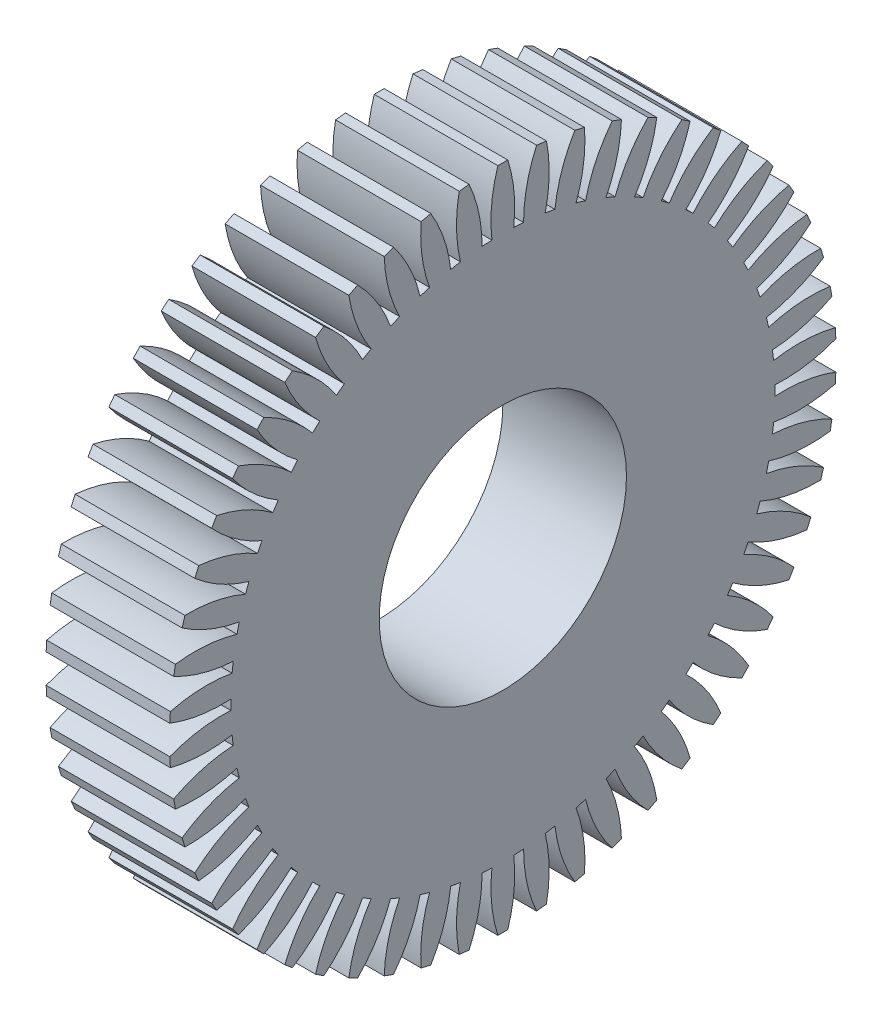
from build123d import *

# Parameters (mm, degrees)
SKETCH1_R               = 135
BOSS_EXTRUDE1_DEPTH     = 50
CUT_EXTRUDE1_DEPTH      = 198.35754356
CUT_EXTRUDE1_DEPTH_BACK = 198.35754356
SKETCH2_OUTSIDE_W       = 349.02
SKETCH2_OUTSIDE_H       = 349.02
CUT_EXTRUDE2_DEPTH      = 197.968696738
CUT_EXTRUDE2_DEPTH_BACK = 197.968696738
SKETCH3_R               = 50


with BuildPart() as part:
    # Sketch1 → Boss-Extrude1 (new body)
    with BuildSketch(Plane.YZ):
        with Locations(Location((0, 0, 0), (0, 0, 270))):
            Circle(SKETCH1_R)
    extrude(amount=BOSS_EXTRUDE1_DEPTH)

    # Sketch2 outside → Cut-Extrude1 (cut, two sides: drawn at the far end of the back side and taken through both)
    with BuildSketch(Plane.YZ.offset(50).offset(-CUT_EXTRUDE1_DEPTH_BACK)):
        Rectangle(SKETCH2_OUTSIDE_W, SKETCH2_OUTSIDE_H)
        with BuildLine():
            Line((5.839655387, 134.659878805), (9.83288802, 134.42729949))
            ThreePointArc((9.83288802, 134.42729949), (11.644041367, 121.999640209), (10.781632884, 109.470344808))
            ThreePointArc((10.781632884, 109.470344808), (12.770220554, 109.256219352), (14.754586315, 109.005973151))
            ThreePointArc((14.754586315, 109.005973151), (16.804878532, 121.396424857), (21.433227473, 133.071414267))
            Line((21.433227473, 133.071414267), (25.372458485, 132.376821556))
            ThreePointArc((25.372458485, 132.376821556), (25.728602279, 119.822931592), (23.417462678, 107.478474318))
            ThreePointArc((23.417462678, 107.478474318), (25.367745782, 107.034935764), (27.30964216, 106.556010835))
            ThreePointArc((27.30964216, 106.556010835), (30.784514681, 118.62465834), (36.736951925, 129.683387133))
            Line((36.736951925, 129.683387133), (40.568909974, 128.536174202))
            ThreePointArc((40.568909974, 128.536174202), (39.465227982, 116.025823379), (35.736611462, 104.03314184))
            ThreePointArc((35.736611462, 104.03314184), (37.622215766, 103.366188286), (39.495381945, 102.665061267))
            ThreePointArc((39.495381945, 102.665061267), (44.34784308, 114.248696818), (51.543872124, 124.541614657))
            Line((51.543872124, 124.541614657), (55.216736552, 122.957295593))
            ThreePointArc((55.216736552, 122.957295593), (52.668154179, 110.659664946), (47.572483882, 99.180939587))
            ThreePointArc((47.572483882, 99.180939587), (49.367909822, 98.299590436), (51.147014443, 97.385742866))
            ThreePointArc((51.147014443, 97.385742866), (57.311442979, 108.327717664), (65.653749876, 117.715630492))
            Line((65.653749876, 117.715630492), (69.117851491, 115.715630492))
            ThreePointArc((69.117851491, 115.715630492), (65.158833941, 103.797024379), (58.765020067, 92.987485268))
            ThreePointArc((58.765020067, 92.987485268), (60.445987588, 91.903659255), (62.106971312, 90.789449356))
            ThreePointArc((62.106971312, 90.789449356), (69.500003928, 100.941791962), (78.875773288, 109.297744364))
            Line((78.875773288, 109.297744364), (82.084266059, 106.909109997))
            ThreePointArc((82.084266059, 106.909109997), (76.768352254, 95.530707119), (69.162860166, 85.53653473))
            ThreePointArc((69.162860166, 85.53653473), (70.706637066, 84.264888743), (72.227037938, 82.965384292))
            ThreePointArc((72.227037938, 82.965384292), (80.74869655, 92.190801688), (91.031137177, 99.401793742))
            Line((91.031137177, 99.401793742), (93.940631743, 96.656827191))
            ThreePointArc((93.940631743, 96.656827191), (87.339710297, 85.972500927), (78.625391229, 76.928849297))
            ThreePointArc((78.625391229, 76.928849297), (80.011100573, 75.486580166), (81.37035778, 74.01935473))
            ThreePointArc((81.37035778, 74.01935473), (90.905401575, 82.193088973), (101.955461098, 88.161604382))
            Line((101.955461098, 88.161604382), (104.526611537, 85.09742661))
            ThreePointArc((104.526611537, 85.09742661), (96.729948589, 75.251664145), (87.024648756, 67.280833146))
            ThreePointArc((87.024648756, 67.280833146), (88.233551203, 65.687445087), (89.413283123, 64.072340375))
            ThreePointArc((89.413283123, 64.072340375), (99.83276699, 71.083855731), (111.50101231, 75.729180563))
            Line((111.50101231, 75.729180563), (113.699048223, 72.387229317))
            ThreePointArc((113.699048223, 72.387229317), (104.812080264, 63.513177698), (94.247047198, 56.722959147))
            ThreePointArc((94.247047198, 56.722959147), (95.262794416, 55), (96.247047198, 53.258857532))
            ThreePointArc((96.247047198, 53.258857532), (107.410065493, 59.013335283), (119.538703609, 62.272649488))
            Line((119.538703609, 62.272649488), (121.33390033, 58.698118927))
            ThreePointArc((121.33390033, 58.698118927), (111.476808357, 50.915784478), (100.194916006, 45.398004433))
            ThreePointArc((100.194916006, 45.398004433), (101.003771757, 43.568774264), (101.779235071, 41.725140005))
            ThreePointArc((101.779235071, 41.725140005), (113.534827121, 46.144760712), (125.959839009, 47.973987657))
            Line((125.959839009, 47.973987657), (127.327919582, 44.215217174))
            ThreePointArc((127.327919582, 44.215217174), (116.634003854, 37.629842619), (104.787820458, 33.459119588))
            ThreePointArc((104.787820458, 33.459119588), (105.378846355, 31.548355598), (105.935033389, 29.627161538))
            ThreePointArc((105.935033389, 29.627161538), (118.124224979, 32.652157413), (130.677583668, 33.026559942))
            Line((130.677583668, 33.026559942), (131.600047151, 29.134380459))
            ThreePointArc((131.600047151, 29.134380459), (120.213924532, 23.835021691), (107.9636494, 21.067757549))
            ThreePointArc((107.9636494, 21.067757549), (108.328852831, 19.101299543), (108.658242111, 17.128526537))
            ThreePointArc((108.658242111, 17.128526537), (121.116195334, 18.717989699), (133.628138183, 17.632504659))
            Line((133.628138183, 17.632504659), (134.09250984, 13.659551228))
            ThreePointArc((134.09250984, 13.659551228), (122.168158107, 9.717872984), (109.679455194, 8.391490231))
            ThreePointArc((109.679455194, 8.391490231), (109.81389741, 6.39593118), (109.91203451, 4.398257598))
            ThreePointArc((109.91203451, 4.398257598), (122.47027692, 4.530693285), (134.771601367, 2))
            Line((134.771601367, 2), (134.771601367, -2))
            ThreePointArc((134.771601367, -2), (122.47027692, -4.530693285), (109.91203451, -4.398257598))
            ThreePointArc((109.91203451, -4.398257598), (109.81389741, -6.39593118), (109.679455194, -8.391490231))
            ThreePointArc((109.679455194, -8.391490231), (122.168158107, -9.717872984), (134.09250984, -13.659551228))
            Line((134.09250984, -13.659551228), (133.628138183, -17.632504659))
            ThreePointArc((133.628138183, -17.632504659), (121.116195334, -18.717989699), (108.658242111, -17.128526537))
            ThreePointArc((108.658242111, -17.128526537), (108.328852831, -19.101299543), (107.9636494, -21.067757549))
            ThreePointArc((107.9636494, -21.067757549), (120.213924532, -23.835021691), (131.600047151, -29.134380459))
            Line((131.600047151, -29.134380459), (130.677583668, -33.026559942))
            ThreePointArc((130.677583668, -33.026559942), (118.124224979, -32.652157413), (105.935033389, -29.627161538))
            ThreePointArc((105.935033389, -29.627161538), (105.378846355, -31.548355598), (104.787820458, -33.459119588))
            ThreePointArc((104.787820458, -33.459119588), (116.634003854, -37.629842619), (127.327919582, -44.215217174))
            Line((127.327919582, -44.215217174), (125.959839009, -47.973987657))
            ThreePointArc((125.959839009, -47.973987657), (113.534827121, -46.144760712), (101.779235071, -41.725140005))
            ThreePointArc((101.779235071, -41.725140005), (101.003771757, -43.568774264), (100.194916006, -45.398004433))
            ThreePointArc((100.194916006, -45.398004433), (111.476808357, -50.915784478), (121.33390033, -58.698118927))
            Line((121.33390033, -58.698118927), (119.538703609, -62.272649488))
            ThreePointArc((119.538703609, -62.272649488), (107.410065493, -59.013335283), (96.247047198, -53.258857532))
            ThreePointArc((96.247047198, -53.258857532), (95.262794416, -55), (94.247047198, -56.722959147))
            ThreePointArc((94.247047198, -56.722959147), (104.812080264, -63.513177698), (113.699048223, -72.387229317))
            Line((113.699048223, -72.387229317), (111.50101231, -75.729180563))
            ThreePointArc((111.50101231, -75.729180563), (99.83276699, -71.083855731), (89.413283123, -64.072340375))
            ThreePointArc((89.413283123, -64.072340375), (88.233551203, -65.687445087), (87.024648756, -67.280833146))
            ThreePointArc((87.024648756, -67.280833146), (96.729948589, -75.251664145), (104.526611537, -85.09742661))
            Line((104.526611537, -85.09742661), (101.955461098, -88.161604382))
            ThreePointArc((101.955461098, -88.161604382), (90.905401575, -82.193088973), (81.37035778, -74.01935473))
            ThreePointArc((81.37035778, -74.01935473), (80.011100573, -75.486580166), (78.625391229, -76.928849297))
            ThreePointArc((78.625391229, -76.928849297), (87.339710297, -85.972500927), (93.940631743, -96.656827191))
            Line((93.940631743, -96.656827191), (91.031137177, -99.401793742))
            ThreePointArc((91.031137177, -99.401793742), (80.74869655, -92.190801688), (72.227037938, -82.965384292))
            ThreePointArc((72.227037938, -82.965384292), (70.706637066, -84.264888743), (69.162860166, -85.53653473))
            ThreePointArc((69.162860166, -85.53653473), (76.768352254, -95.530707119), (82.084266059, -106.909109997))
            Line((82.084266059, -106.909109997), (78.875773288, -109.297744364))
            ThreePointArc((78.875773288, -109.297744364), (69.500003928, -100.941791962), (62.106971312, -90.789449356))
            ThreePointArc((62.106971312, -90.789449356), (60.445987588, -91.903659255), (58.765020067, -92.987485268))
            ThreePointArc((58.765020067, -92.987485268), (65.158833941, -103.797024379), (69.117851491, -115.715630492))
            Line((69.117851491, -115.715630492), (65.653749876, -117.715630492))
            ThreePointArc((65.653749876, -117.715630492), (57.311442979, -108.327717664), (51.147014443, -97.385742866))
            ThreePointArc((51.147014443, -97.385742866), (49.367909822, -98.299590436), (47.572483882, -99.180939587))
            ThreePointArc((47.572483882, -99.180939587), (52.668154179, -110.659664946), (55.216736552, -122.957295593))
            Line((55.216736552, -122.957295593), (51.543872124, -124.541614657))
            ThreePointArc((51.543872124, -124.541614657), (44.34784308, -114.248696818), (39.495381945, -102.665061267))
            ThreePointArc((39.495381945, -102.665061267), (37.622215766, -103.366188286), (35.736611462, -104.03314184))
            ThreePointArc((35.736611462, -104.03314184), (39.465227982, -116.025823379), (40.568909974, -128.536174202))
            Line((40.568909974, -128.536174202), (36.736951925, -129.683387133))
            ThreePointArc((36.736951925, -129.683387133), (30.784514681, -118.62465834), (27.30964216, -106.556010835))
            ThreePointArc((27.30964216, -106.556010835), (25.367745782, -107.034935764), (23.417462678, -107.478474318))
            ThreePointArc((23.417462678, -107.478474318), (25.728602279, -119.822931592), (25.372458485, -132.376821556))
            Line((25.372458485, -132.376821556), (21.433227473, -133.071414267))
            ThreePointArc((21.433227473, -133.071414267), (16.804878532, -121.396424857), (14.754586315, -109.005973151))
            ThreePointArc((14.754586315, -109.005973151), (12.770220554, -109.256219352), (10.781632884, -109.470344808))
            ThreePointArc((10.781632884, -109.470344808), (11.644041367, -121.999640209), (9.83288802, -134.42729949))
            Line((9.83288802, -134.42729949), (5.839655387, -134.659878805))
            ThreePointArc((5.839655387, -134.659878805), (2.597985229, -122.526512981), (2, -109.981816679))
            ThreePointArc((2, -109.981816679), (0, -110), (-2, -109.981816679))
            ThreePointArc((-2, -109.981816679), (-2.597985229, -122.526512981), (-5.839655387, -134.659878805))
            Line((-5.839655387, -134.659878805), (-9.83288802, -134.42729949))
            ThreePointArc((-9.83288802, -134.42729949), (-11.644041367, -121.999640209), (-10.781632884, -109.470344808))
            ThreePointArc((-10.781632884, -109.470344808), (-12.770220554, -109.256219352), (-14.754586315, -109.005973151))
            ThreePointArc((-14.754586315, -109.005973151), (-16.804878532, -121.396424857), (-21.433227473, -133.071414267))
            Line((-21.433227473, -133.071414267), (-25.372458485, -132.376821556))
            ThreePointArc((-25.372458485, -132.376821556), (-25.728602279, -119.822931592), (-23.417462678, -107.478474318))
            ThreePointArc((-23.417462678, -107.478474318), (-25.367745782, -107.034935764), (-27.30964216, -106.556010835))
            ThreePointArc((-27.30964216, -106.556010835), (-30.784514681, -118.62465834), (-36.736951925, -129.683387133))
            Line((-36.736951925, -129.683387133), (-40.568909974, -128.536174202))
            ThreePointArc((-40.568909974, -128.536174202), (-39.465227982, -116.025823379), (-35.736611462, -104.03314184))
            ThreePointArc((-35.736611462, -104.03314184), (-37.622215766, -103.366188286), (-39.495381945, -102.665061267))
            ThreePointArc((-39.495381945, -102.665061267), (-44.34784308, -114.248696818), (-51.543872124, -124.541614657))
            Line((-51.543872124, -124.541614657), (-55.216736552, -122.957295593))
            ThreePointArc((-55.216736552, -122.957295593), (-52.668154179, -110.659664946), (-47.572483882, -99.180939587))
            ThreePointArc((-47.572483882, -99.180939587), (-49.367909822, -98.299590436), (-51.147014443, -97.385742866))
            ThreePointArc((-51.147014443, -97.385742866), (-57.311442979, -108.327717664), (-65.653749876, -117.715630492))
            Line((-65.653749876, -117.715630492), (-69.117851491, -115.715630492))
            ThreePointArc((-69.117851491, -115.715630492), (-65.158833941, -103.797024379), (-58.765020067, -92.987485268))
            ThreePointArc((-58.765020067, -92.987485268), (-60.445987588, -91.903659255), (-62.106971312, -90.789449356))
            ThreePointArc((-62.106971312, -90.789449356), (-69.500003928, -100.941791962), (-78.875773288, -109.297744364))
            Line((-78.875773288, -109.297744364), (-82.084266059, -106.909109997))
            ThreePointArc((-82.084266059, -106.909109997), (-76.768352254, -95.530707119), (-69.162860166, -85.53653473))
            ThreePointArc((-69.162860166, -85.53653473), (-70.706637066, -84.264888743), (-72.227037938, -82.965384292))
            ThreePointArc((-72.227037938, -82.965384292), (-80.74869655, -92.190801688), (-91.031137177, -99.401793742))
            Line((-91.031137177, -99.401793742), (-93.940631743, -96.656827191))
            ThreePointArc((-93.940631743, -96.656827191), (-87.339710297, -85.972500927), (-78.625391229, -76.928849297))
            ThreePointArc((-78.625391229, -76.928849297), (-80.011100573, -75.486580166), (-81.37035778, -74.01935473))
            ThreePointArc((-81.37035778, -74.01935473), (-90.905401575, -82.193088973), (-101.955461098, -88.161604382))
            Line((-101.955461098, -88.161604382), (-104.526611537, -85.09742661))
            ThreePointArc((-104.526611537, -85.09742661), (-96.729948589, -75.251664145), (-87.024648756, -67.280833146))
            ThreePointArc((-87.024648756, -67.280833146), (-88.233551203, -65.687445087), (-89.413283123, -64.072340375))
            ThreePointArc((-89.413283123, -64.072340375), (-99.83276699, -71.083855731), (-111.50101231, -75.729180563))
            Line((-111.50101231, -75.729180563), (-113.699048223, -72.387229317))
            ThreePointArc((-113.699048223, -72.387229317), (-104.812080264, -63.513177698), (-94.247047198, -56.722959147))
            ThreePointArc((-94.247047198, -56.722959147), (-95.262794416, -55), (-96.247047198, -53.258857532))
            ThreePointArc((-96.247047198, -53.258857532), (-107.410065493, -59.013335283), (-119.538703609, -62.272649488))
            Line((-119.538703609, -62.272649488), (-121.33390033, -58.698118927))
            ThreePointArc((-121.33390033, -58.698118927), (-111.476808357, -50.915784478), (-100.194916006, -45.398004433))
            ThreePointArc((-100.194916006, -45.398004433), (-101.003771757, -43.568774264), (-101.779235071, -41.725140005))
            ThreePointArc((-101.779235071, -41.725140005), (-113.534827121, -46.144760712), (-125.959839009, -47.973987657))
            Line((-125.959839009, -47.973987657), (-127.327919582, -44.215217174))
            ThreePointArc((-127.327919582, -44.215217174), (-116.634003854, -37.629842619), (-104.787820458, -33.459119588))
            ThreePointArc((-104.787820458, -33.459119588), (-105.378846355, -31.548355598), (-105.935033389, -29.627161538))
            ThreePointArc((-105.935033389, -29.627161538), (-118.124224979, -32.652157413), (-130.677583668, -33.026559942))
            Line((-130.677583668, -33.026559942), (-131.600047151, -29.134380459))
            ThreePointArc((-131.600047151, -29.134380459), (-120.213924532, -23.835021691), (-107.9636494, -21.067757549))
            ThreePointArc((-107.9636494, -21.067757549), (-108.328852831, -19.101299543), (-108.658242111, -17.128526537))
            ThreePointArc((-108.658242111, -17.128526537), (-121.116195334, -18.717989699), (-133.628138183, -17.632504659))
            Line((-133.628138183, -17.632504659), (-134.09250984, -13.659551228))
            ThreePointArc((-134.09250984, -13.659551228), (-122.168158107, -9.717872984), (-109.679455194, -8.391490231))
            ThreePointArc((-109.679455194, -8.391490231), (-109.81389741, -6.39593118), (-109.91203451, -4.398257598))
            ThreePointArc((-109.91203451, -4.398257598), (-122.47027692, -4.530693285), (-134.771601367, -2))
            Line((-134.771601367, -2), (-134.771601367, 2))
            ThreePointArc((-134.771601367, 2), (-122.47027692, 4.530693285), (-109.91203451, 4.398257598))
            ThreePointArc((-109.91203451, 4.398257598), (-109.81389741, 6.39593118), (-109.679455194, 8.391490231))
            ThreePointArc((-109.679455194, 8.391490231), (-122.168158107, 9.717872984), (-134.09250984, 13.659551228))
            Line((-134.09250984, 13.659551228), (-133.628138183, 17.632504659))
            ThreePointArc((-133.628138183, 17.632504659), (-121.116195334, 18.717989699), (-108.658242111, 17.128526537))
            ThreePointArc((-108.658242111, 17.128526537), (-108.328852831, 19.101299543), (-107.9636494, 21.067757549))
            ThreePointArc((-107.9636494, 21.067757549), (-120.213924532, 23.835021691), (-131.600047151, 29.134380459))
            Line((-131.600047151, 29.134380459), (-130.677583668, 33.026559942))
            ThreePointArc((-130.677583668, 33.026559942), (-118.124224979, 32.652157413), (-105.935033389, 29.627161538))
            ThreePointArc((-105.935033389, 29.627161538), (-105.378846355, 31.548355598), (-104.787820458, 33.459119588))
            ThreePointArc((-104.787820458, 33.459119588), (-116.634003854, 37.629842619), (-127.327919582, 44.215217174))
            Line((-127.327919582, 44.215217174), (-125.959839009, 47.973987657))
            ThreePointArc((-125.959839009, 47.973987657), (-113.534827121, 46.144760712), (-101.779235071, 41.725140005))
            ThreePointArc((-101.779235071, 41.725140005), (-101.003771757, 43.568774264), (-100.194916006, 45.398004433))
            ThreePointArc((-100.194916006, 45.398004433), (-111.476808357, 50.915784478), (-121.33390033, 58.698118927))
            Line((-121.33390033, 58.698118927), (-119.538703609, 62.272649488))
            ThreePointArc((-119.538703609, 62.272649488), (-107.410065493, 59.013335283), (-96.247047198, 53.258857532))
            ThreePointArc((-96.247047198, 53.258857532), (-95.262794416, 55), (-94.247047198, 56.722959147))
            ThreePointArc((-94.247047198, 56.722959147), (-104.812080264, 63.513177698), (-113.699048223, 72.387229317))
            Line((-113.699048223, 72.387229317), (-111.50101231, 75.729180563))
            ThreePointArc((-111.50101231, 75.729180563), (-99.83276699, 71.083855731), (-89.413283123, 64.072340375))
            ThreePointArc((-89.413283123, 64.072340375), (-88.233551203, 65.687445087), (-87.024648756, 67.280833146))
            ThreePointArc((-87.024648756, 67.280833146), (-96.729948589, 75.251664145), (-104.526611537, 85.09742661))
            Line((-104.526611537, 85.09742661), (-101.955461098, 88.161604382))
            ThreePointArc((-101.955461098, 88.161604382), (-90.905401575, 82.193088973), (-81.37035778, 74.01935473))
            ThreePointArc((-81.37035778, 74.01935473), (-80.011100573, 75.486580166), (-78.625391229, 76.928849297))
            ThreePointArc((-78.625391229, 76.928849297), (-87.339710297, 85.972500927), (-93.940631743, 96.656827191))
            Line((-93.940631743, 96.656827191), (-91.031137177, 99.401793742))
            ThreePointArc((-91.031137177, 99.401793742), (-80.74869655, 92.190801688), (-72.227037938, 82.965384292))
            ThreePointArc((-72.227037938, 82.965384292), (-70.706637066, 84.264888743), (-69.162860166, 85.53653473))
            ThreePointArc((-69.162860166, 85.53653473), (-76.768352254, 95.530707119), (-82.084266059, 106.909109997))
            Line((-82.084266059, 106.909109997), (-78.875773288, 109.297744364))
            ThreePointArc((-78.875773288, 109.297744364), (-69.500003928, 100.941791962), (-62.106971312, 90.789449356))
            ThreePointArc((-62.106971312, 90.789449356), (-60.445987588, 91.903659255), (-58.765020067, 92.987485268))
            ThreePointArc((-58.765020067, 92.987485268), (-65.158833941, 103.797024379), (-69.117851491, 115.715630492))
            Line((-69.117851491, 115.715630492), (-65.653749876, 117.715630492))
            ThreePointArc((-65.653749876, 117.715630492), (-57.311442979, 108.327717664), (-51.147014443, 97.385742866))
            ThreePointArc((-51.147014443, 97.385742866), (-49.367909822, 98.299590436), (-47.572483882, 99.180939587))
            ThreePointArc((-47.572483882, 99.180939587), (-52.668154179, 110.659664946), (-55.216736552, 122.957295593))
            Line((-55.216736552, 122.957295593), (-51.543872124, 124.541614657))
            ThreePointArc((-51.543872124, 124.541614657), (-44.34784308, 114.248696818), (-39.495381945, 102.665061267))
            ThreePointArc((-39.495381945, 102.665061267), (-37.622215766, 103.366188286), (-35.736611462, 104.03314184))
            ThreePointArc((-35.736611462, 104.03314184), (-39.465227982, 116.025823379), (-40.568909974, 128.536174202))
            Line((-40.568909974, 128.536174202), (-36.736951925, 129.683387133))
            ThreePointArc((-36.736951925, 129.683387133), (-30.784514681, 118.62465834), (-27.30964216, 106.556010835))
            ThreePointArc((-27.30964216, 106.556010835), (-25.367745782, 107.034935764), (-23.417462678, 107.478474318))
            ThreePointArc((-23.417462678, 107.478474318), (-25.728602279, 119.822931592), (-25.372458485, 132.376821556))
            Line((-25.372458485, 132.376821556), (-21.433227473, 133.071414267))
            ThreePointArc((-21.433227473, 133.071414267), (-16.804878532, 121.396424857), (-14.754586315, 109.005973151))
            ThreePointArc((-14.754586315, 109.005973151), (-12.770220554, 109.256219352), (-10.781632884, 109.470344808))
            ThreePointArc((-10.781632884, 109.470344808), (-11.644041367, 121.999640209), (-9.83288802, 134.42729949))
            Line((-9.83288802, 134.42729949), (-5.839655387, 134.659878805))
            ThreePointArc((-5.839655387, 134.659878805), (-2.597985229, 122.526512981), (-2, 109.981816679))
            ThreePointArc((-2, 109.981816679), (0, 110), (2, 109.981816679))
            ThreePointArc((2, 109.981816679), (2.597985229, 122.526512981), (5.839655387, 134.659878805))
        make_face(mode=Mode.SUBTRACT)
    extrude(amount=CUT_EXTRUDE1_DEPTH + CUT_EXTRUDE1_DEPTH_BACK, mode=Mode.SUBTRACT)

    # Sketch3 → Cut-Extrude2 (cut, two sides: drawn at the far end of the back side and taken through both)
    with BuildSketch(Plane.YZ.offset(50).offset(-CUT_EXTRUDE2_DEPTH_BACK)):
        with Locations(Location((0, 0, 0), (0, 0, 270))):
            Circle(SKETCH3_R)
    extrude(amount=CUT_EXTRUDE2_DEPTH + CUT_EXTRUDE2_DEPTH_BACK, mode=Mode.SUBTRACT)


solid = part.part
